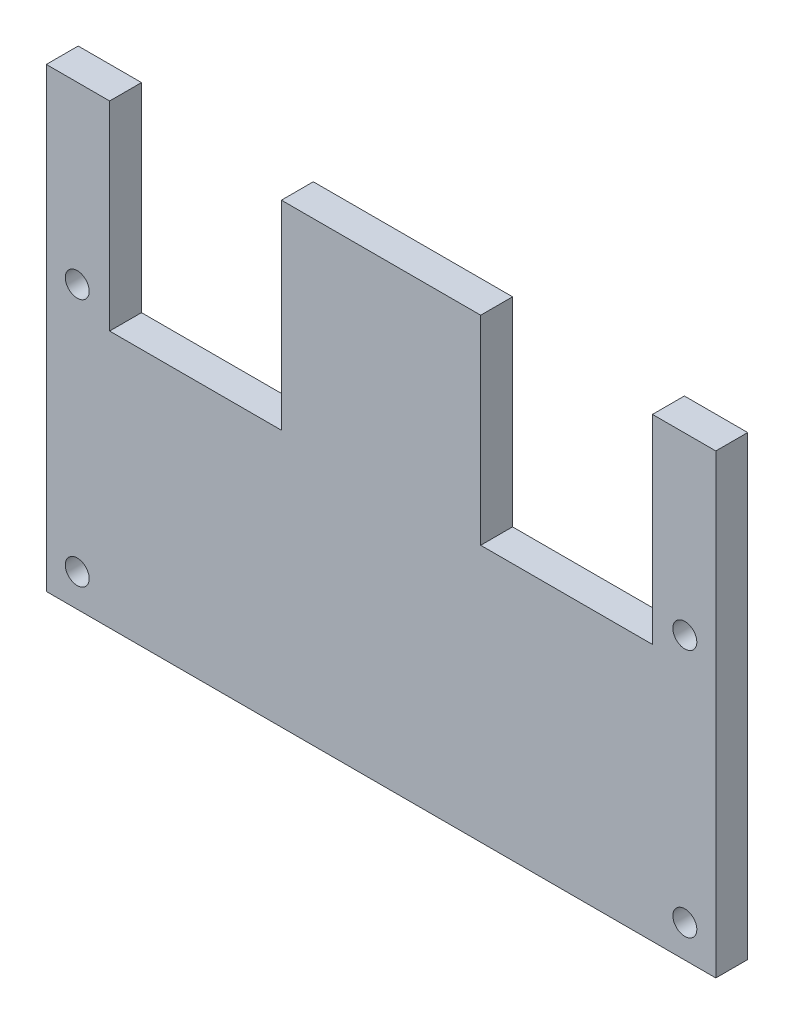
from build123d import *

# Parameters (mm, degrees)
EXTRUDE_1_DEPTH          = 4
CUT_EXTRUDE_1_DEPTH      = 72.212602073
CUT_EXTRUDE_1_DEPTH_BACK = 72.212602073
SKETCH_7_R               = 1.5


with BuildPart() as part:
    # 草图1 → 凸台-拉伸1 (new body)
    with BuildSketch(Plane.XY):
        Polygon((-42.136394103, 0), (41.863605897, 0), (41.863605897, 57.269180071), (33.918605897, 57.269180071), (33.918605897, 32.269180071), (12.363605897, 32.269180071), (12.363605897, 57.269180071), (-12.636394103, 57.269180071), (-12.636394103, 32.269180071), (-34.191394103, 32.269180071), (-34.191394103, 57.269180071), (-42.136394103, 57.269180071), align=None)
    extrude(amount=EXTRUDE_1_DEPTH)

    # 草图7 → 切除-拉伸1 (cut, two sides: drawn at the far end of the back side and taken through both)
    with BuildSketch(Plane.XY.offset(4).offset(-CUT_EXTRUDE_1_DEPTH_BACK)):
        with Locations((-38.253699842, 4.077877428)):
            Circle(SKETCH_7_R)
        with Locations((-38.253699842, 35.306046983)):
            Circle(SKETCH_7_R)
        with Locations(Location((37.980911635, 35.306046983, 0), (0, 0, 180))):
            Circle(SKETCH_7_R)
        with Locations(Location((37.980911635, 4.077877428, 0), (0, 0, 180))):
            Circle(SKETCH_7_R)
    extrude(amount=CUT_EXTRUDE_1_DEPTH + CUT_EXTRUDE_1_DEPTH_BACK, mode=Mode.SUBTRACT)


solid = part.part
